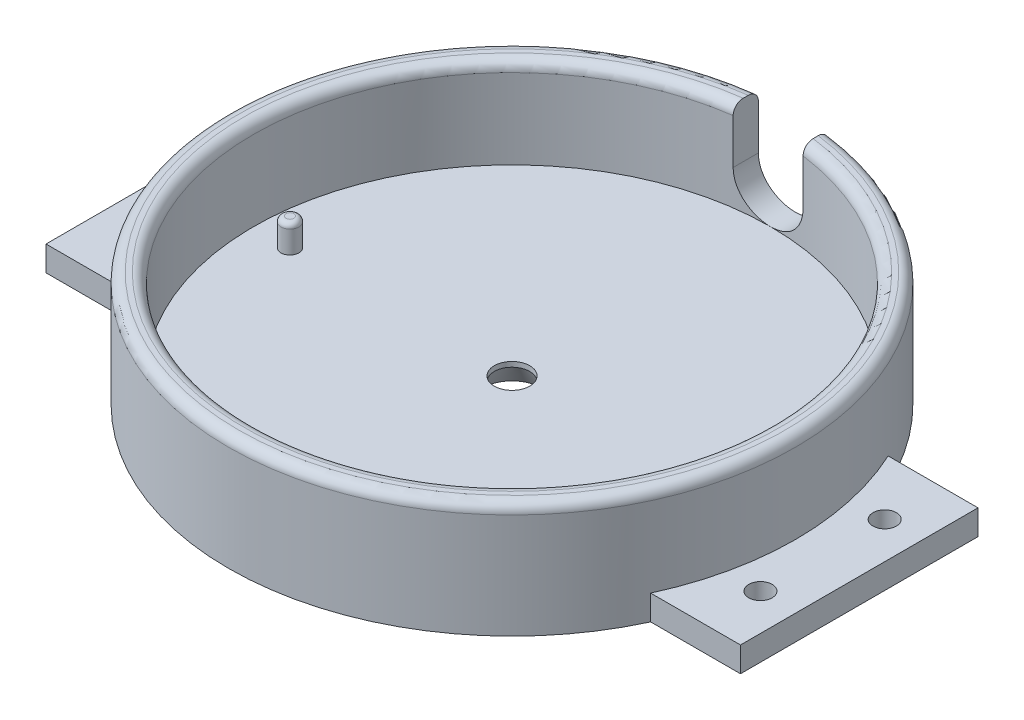
from build123d import *

# Parameters (mm, degrees)
SKETCH1_R               = 56.75
BOSS_EXTRUDE3_DEPTH     = 23
SKETCH10_R              = 51.75
CUT_EXTRUDE3_DEPTH      = 18
SKETCH12_R              = 3.55
CUT_EXTRUDE4_DEPTH      = 83.250379938
SKETCH17_R              = 1.8
BOSS_EXTRUDE4_DEPTH     = 5.5
SKETCH18_R              = 1.8
BOSS_EXTRUDE5_DEPTH     = 5.5
FILLET5_R               = 1
FILLET6_R               = 1
CUT_EXTRUDE5_DEPTH      = 3
CUT_EXTRUDE5_DEPTH_BACK = 3
FILLET7_R               = 2
FILLET8_R               = 2
CHAMFER1_SIZE           = 4
CHAMFER1_SIZE2          = 2.309401077
SKETCH34_W              = 47.55
SKETCH34_H              = 5
BOSS_EXTRUDE6_DEPTH     = 29.515
SKETCH35_W              = 47.55
SKETCH35_H              = 5
BOSS_EXTRUDE7_DEPTH     = 29.515
CUT_EXTRUDE6_REACH      = 94.639
SKETCH42_R              = 2.34
CUT_EXTRUDE7_REACH      = 94.639
SKETCH43_R              = 2.34
CUT_EXTRUDE8_REACH      = 94.639
SKETCH44_R              = 2.34
CUT_EXTRUDE9_REACH      = 94.639
SKETCH45_R              = 2.34


with BuildPart() as part:
    # Sketch1 → Boss-Extrude3 (new body)
    with BuildSketch(Plane(origin=(0, 0, 0), x_dir=(1, 0, 0), z_dir=(0, 1, 0))):
        Circle(SKETCH1_R)
    extrude(amount=BOSS_EXTRUDE3_DEPTH)

    # Sketch10 → Cut-Extrude3 (cut)
    with BuildSketch(Plane(origin=(0, 23, 0), x_dir=(1, 0, 0), z_dir=(0, 1, 0))):
        Circle(SKETCH10_R)
    extrude(amount=-CUT_EXTRUDE3_DEPTH, mode=Mode.SUBTRACT)

    # Sketch12 → Cut-Extrude4 (cut, through all)
    with BuildSketch(Plane(origin=(0, 5, 0), x_dir=(1, 0, 0), z_dir=(0, 1, 0))):
        Circle(SKETCH12_R)
    extrude(amount=-CUT_EXTRUDE4_DEPTH, mode=Mode.SUBTRACT)

    # Sketch17 → Boss-Extrude4 (add)
    with BuildSketch(Plane(origin=(0, 5, 0), x_dir=(1, 0, 0), z_dir=(0, 1, 0))):
        with Locations((-44.45, 0)):
            Circle(SKETCH17_R)
    extrude(amount=BOSS_EXTRUDE4_DEPTH)

    # Sketch18 → Boss-Extrude5 (add)
    with BuildSketch(Plane(origin=(0, 5, 0), x_dir=(1, 0, 0), z_dir=(0, 1, 0))):
        with Locations((44.45, 0)):
            Circle(SKETCH18_R)
    extrude(amount=BOSS_EXTRUDE5_DEPTH)

    # Fillet5
    fillet5_edges = [part.edges().sort_by_distance(p)[0] for p in [
        (-46.25, 10.5, 0),
    ]]
    fillet(fillet5_edges, radius=FILLET5_R)

    # Fillet6
    fillet6_edges = [part.edges().sort_by_distance(p)[0] for p in [
        (42.65, 10.5, 0),
    ]]
    fillet(fillet6_edges, radius=FILLET6_R)

    # Sketch27 → Cut-Extrude5 (cut, two sides: drawn at the far end of the back side and taken through both)
    with BuildSketch(Plane.XY.offset(-54.25).offset(-CUT_EXTRUDE5_DEPTH_BACK)):
        with BuildLine():
            Line((7, 23), (7, 12))
            ThreePointArc((7, 12), (0, 5), (-7, 12))
            Line((-7, 12), (-7, 23))
            ThreePointArc((-7, 23), (0, 30), (7, 23))
        make_face()
    extrude(amount=CUT_EXTRUDE5_DEPTH + CUT_EXTRUDE5_DEPTH_BACK, mode=Mode.SUBTRACT)

    # Fillet7
    fillet7_edges = [part.edges().sort_by_distance(p)[0] for p in [
        (-34.028021541, 23, 38.989181192),
    ]]
    fillet(fillet7_edges, radius=FILLET7_R)

    # Fillet8
    fillet8_edges = [part.edges().sort_by_distance(p)[0] for p in [
        (-37.572014186, 23, 42.531238519),
    ]]
    fillet(fillet8_edges, radius=FILLET8_R)

    # Chamfer1
    chamfer1_edges = [part.edges().sort_by_distance(p)[0] for p in [
        (-3.55, 0, 0),
    ]]
    chamfer1_side = [part.faces().sort_by_distance(p)[0] for p in [
        (-3.55, 2.5, 0),
    ]]
    chamfer(chamfer1_edges, length=CHAMFER1_SIZE, length2=CHAMFER1_SIZE2, reference=chamfer1_side[0])

    # Sketch34 → Boss-Extrude6 (add)
    with BuildSketch(Plane(origin=(-40, 0, 0), x_dir=(0, 0, -1), z_dir=(1, 0, 0))):
        with Locations((0, 2.5)):
            Rectangle(SKETCH34_W, SKETCH34_H)
    extrude(amount=-BOSS_EXTRUDE6_DEPTH)

    # Sketch35 → Boss-Extrude7 (add)
    with BuildSketch(Plane(origin=(40, 0, 0), x_dir=(0, 0, -1), z_dir=(1, 0, 0))):
        with Locations((0, 2.5)):
            Rectangle(SKETCH35_W, SKETCH35_H)
    extrude(amount=BOSS_EXTRUDE7_DEPTH)

    # Sketch42 → Cut-Extrude6 (cut, up to next)
    with BuildSketch(Plane.XZ, mode=Mode.PRIVATE) as cut_extrude6_sk1:
        with Locations((62.175, -12.435)):
            Circle(SKETCH42_R)
    cut_extrude6_tool1 = extrude(cut_extrude6_sk1.sketch, amount=-CUT_EXTRUDE6_REACH, mode=Mode.PRIVATE) & part.part
    add(cut_extrude6_tool1.solids().sort_by_distance((62.175, 0, -12.435))[0], mode=Mode.SUBTRACT)

    # Sketch43 → Cut-Extrude7 (cut, up to next)
    with BuildSketch(Plane(origin=(0, 0, 0), x_dir=(-1, 0, 0), z_dir=(0, -1, 0)), mode=Mode.PRIVATE) as cut_extrude7_sk1:
        with Locations((-62.175, -12.435)):
            Circle(SKETCH43_R)
    cut_extrude7_tool1 = extrude(cut_extrude7_sk1.sketch, amount=-CUT_EXTRUDE7_REACH, mode=Mode.PRIVATE) & part.part
    add(cut_extrude7_tool1.solids().sort_by_distance((62.175, 0, 12.435))[0], mode=Mode.SUBTRACT)

    # Sketch44 → Cut-Extrude8 (cut, up to next)
    with BuildSketch(Plane(origin=(0, 0, 0), x_dir=(-1, 0, 0), z_dir=(0, -1, 0)), mode=Mode.PRIVATE) as cut_extrude8_sk1:
        with Locations((62.175, 12.435)):
            Circle(SKETCH44_R)
    cut_extrude8_tool1 = extrude(cut_extrude8_sk1.sketch, amount=-CUT_EXTRUDE8_REACH, mode=Mode.PRIVATE) & part.part
    add(cut_extrude8_tool1.solids().sort_by_distance((-62.175, 0, -12.435))[0], mode=Mode.SUBTRACT)

    # Sketch45 → Cut-Extrude9 (cut, up to next)
    with BuildSketch(Plane(origin=(0, 0, 0), x_dir=(-1, 0, 0), z_dir=(0, -1, 0)), mode=Mode.PRIVATE) as cut_extrude9_sk1:
        with Locations((62.175, -12.435)):
            Circle(SKETCH45_R)
    cut_extrude9_tool1 = extrude(cut_extrude9_sk1.sketch, amount=-CUT_EXTRUDE9_REACH, mode=Mode.PRIVATE) & part.part
    add(cut_extrude9_tool1.solids().sort_by_distance((-62.175, 0, 12.435))[0], mode=Mode.SUBTRACT)


solid = part.part
